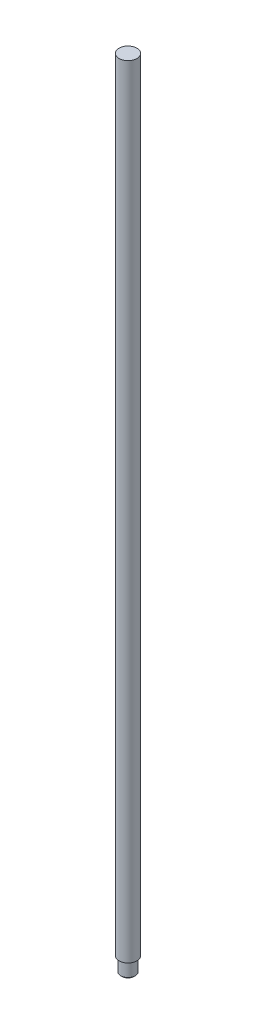
from build123d import *

# Parameters (mm, degrees)
SKETCH1_R           = 4.953
BOSS_EXTRUDE1_DEPTH = 431.8
SKETCH2_R           = 4
BOSS_EXTRUDE2_DEPTH = 8.382
CHAMFER1_SIZE       = 0.762


with BuildPart() as part:
    # Sketch1 → Boss-Extrude1 (new body)
    with BuildSketch(Plane(origin=(0, 0, 0), x_dir=(1, 0, 0), z_dir=(0, 1, 0))):
        with Locations(Location((0, 0, 0), (0, 0, 270))):
            Circle(SKETCH1_R)
    extrude(amount=BOSS_EXTRUDE1_DEPTH)

    # Sketch2 → Boss-Extrude2 (add)
    with BuildSketch(Plane.XZ):
        with Locations(Location((0, 0, 0), (0, 0, 90))):
            Circle(SKETCH2_R)
    extrude(amount=BOSS_EXTRUDE2_DEPTH)

    # Chamfer1
    chamfer1_edges = [part.edges().sort_by_distance(p)[0] for p in [
        (0, -8.382, -4),
    ]]
    chamfer(chamfer1_edges, length=CHAMFER1_SIZE)


solid = part.part
